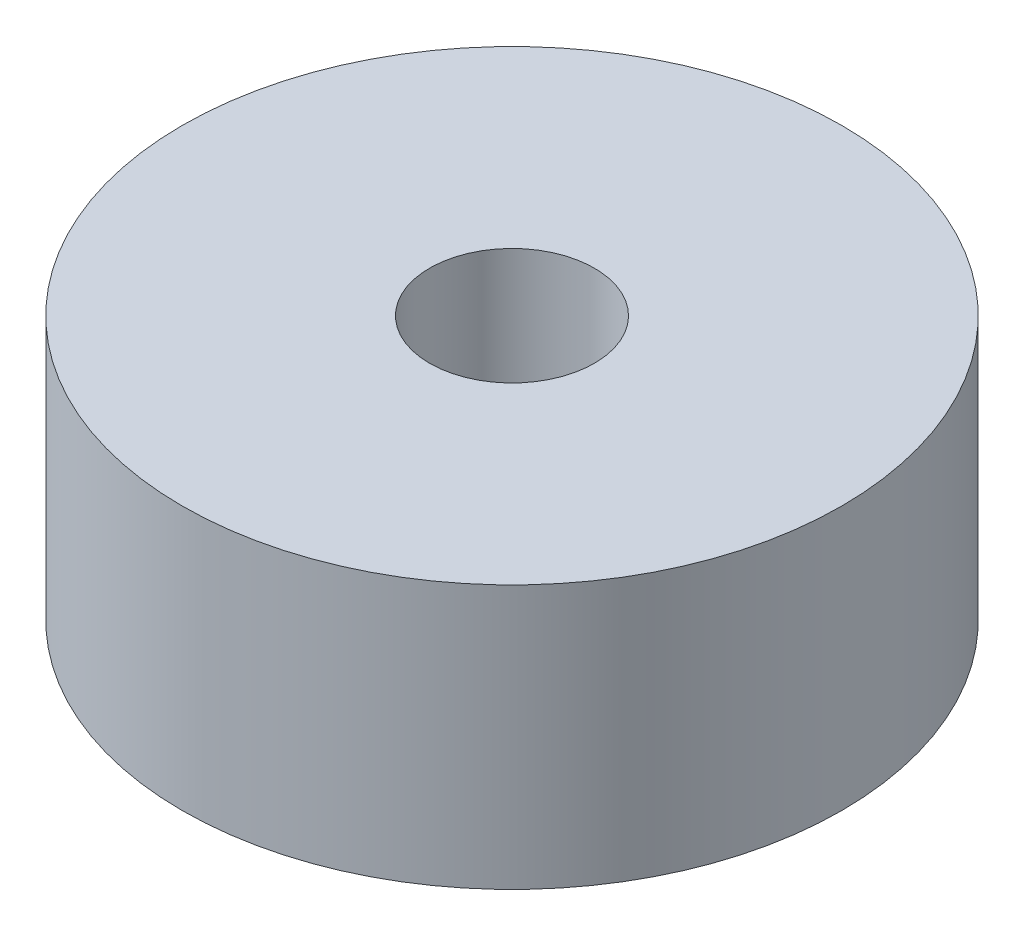
from build123d import *

# Parameters (mm, degrees)
SKETCH_1_R          = 10
EXTRUDE_1_DEPTH     = 8
SKETCH_2_R          = 2.5
CUT_EXTRUDE_1_DEPTH = 8


with BuildPart() as part:
    # 草图1 → 凸台-拉伸1 (new body)
    with BuildSketch(Plane(origin=(0, 0, 0), x_dir=(1, 0, 0), z_dir=(0, 1, 0))):
        with Locations(Location((0, 0, 0), (0, 0, 270))):
            Circle(SKETCH_1_R)
    extrude(amount=EXTRUDE_1_DEPTH)

    # 草图2 → 切除-拉伸1 (cut)
    with BuildSketch(Plane(origin=(0, 8, 0), x_dir=(1, 0, 0), z_dir=(0, 1, 0))):
        with Locations(Location((0, 0, 0), (0, 0, 270))):
            Circle(SKETCH_2_R)
    extrude(amount=-CUT_EXTRUDE_1_DEPTH, mode=Mode.SUBTRACT)


solid = part.part
